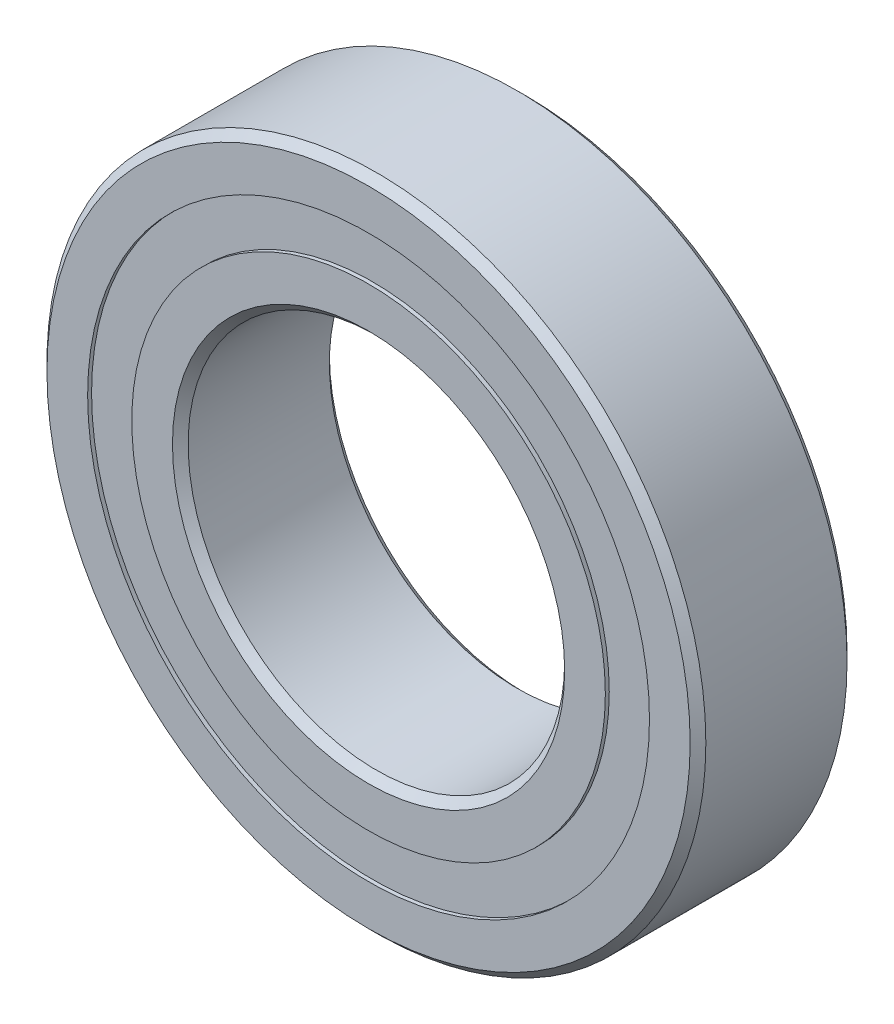
from build123d import *

# Parameters (mm, degrees)
CIRPATTERN1_COUNT = 12
SKETCH5_W         = 1.060011729
SKETCH5_H         = 1.406593406


with BuildPart() as part:
    # Sketch1 → Revolve1 (revolve)
    with BuildSketch(Plane(origin=(0, 0, 0), x_dir=(0, 0, -1), z_dir=(1, 0, 0)), mode=Mode.PRIVATE) as revolve1_sk:
        with BuildLine():
            Line((2.25, 10.5), (-2.25, 10.5))
            Line((-2.25, 10.5), (-2.5, 10.25))
            Line((-2.5, 10.25), (-2.5, 8.953296703))
            Line((-2.5, 8.953296703), (-1.111111111, 8.953296703))
            ThreePointArc((-1.111111111, 8.953296703), (0, 9.564988271), (1.111111111, 8.953296703))
            Line((1.111111111, 8.953296703), (2.5, 8.953296703))
            Line((2.5, 8.953296703), (2.5, 10.25))
            Line((2.5, 10.25), (2.25, 10.5))
        make_face()
    revolve(revolve1_sk.sketch.rotate(Axis((0, 0, 2.5), (0, 0, -1)), 90), axis=Axis((0, 0, 2.5), (0, 0, -1)))


with BuildPart() as body_2:
    # Sketch3 → Revolve3 (revolve)
    with BuildSketch(Plane(origin=(0, 0, 0), x_dir=(0, 0, -1), z_dir=(1, 0, 0)), mode=Mode.PRIVATE) as revolve3_sk:
        with BuildLine():
            Line((-2.5, 7.546703297), (-1.111111111, 7.546703297))
            ThreePointArc((-1.111111111, 7.546703297), (0, 6.935011729), (1.111111111, 7.546703297))
            Line((1.111111111, 7.546703297), (2.5, 7.546703297))
            Line((2.5, 7.546703297), (2.5, 6.25))
            Line((2.5, 6.25), (2.25, 6))
            Line((2.25, 6), (-2.25, 6))
            Line((-2.25, 6), (-2.5, 6.25))
            Line((-2.5, 6.25), (-2.5, 7.546703297))
        make_face()
    revolve(revolve3_sk.sketch.rotate(Axis((0, 0, 2.5), (0, 0, -1)), 90), axis=Axis((0, 0, 2.5), (0, 0, -1)))


with BuildPart() as body_3:
    # Sketch4 → Revolve4 (revolve)
    with BuildSketch(Plane(origin=(0, 0, 0), x_dir=(0, 0, -1), z_dir=(1, 0, 0))):
        with BuildLine():
            Line((-1.314988271, 8.25), (1.314988271, 8.25))
            ThreePointArc((1.314988271, 8.25), (0, 9.564988271), (-1.314988271, 8.25))
        make_face()
    revolve(axis=Axis((0, 8.25, 1.314988271), (0, 0, -1)))


with BuildPart() as cirpattern1_1:
    # CirPattern1: pattern copy
    add(body_3.part.rotate(Axis((0, 0, 0), (0, 0, 1)), 1 * 360 / CIRPATTERN1_COUNT))


with BuildPart() as cirpattern1_2:
    # CirPattern1: pattern copy
    add(body_3.part.rotate(Axis((0, 0, 0), (0, 0, 1)), 2 * 360 / CIRPATTERN1_COUNT))


with BuildPart() as cirpattern1_3:
    # CirPattern1: pattern copy
    add(body_3.part.rotate(Axis((0, 0, 0), (0, 0, 1)), 3 * 360 / CIRPATTERN1_COUNT))


with BuildPart() as cirpattern1_4:
    # CirPattern1: pattern copy
    add(body_3.part.rotate(Axis((0, 0, 0), (0, 0, 1)), 4 * 360 / CIRPATTERN1_COUNT))


with BuildPart() as cirpattern1_5:
    # CirPattern1: pattern copy
    add(body_3.part.rotate(Axis((0, 0, 0), (0, 0, 1)), 5 * 360 / CIRPATTERN1_COUNT))


with BuildPart() as cirpattern1_6:
    # CirPattern1: pattern copy
    add(body_3.part.rotate(Axis((0, 0, 0), (0, 0, 1)), 6 * 360 / CIRPATTERN1_COUNT))


with BuildPart() as cirpattern1_7:
    # CirPattern1: pattern copy
    add(body_3.part.rotate(Axis((0, 0, 0), (0, 0, 1)), 7 * 360 / CIRPATTERN1_COUNT))


with BuildPart() as cirpattern1_8:
    # CirPattern1: pattern copy
    add(body_3.part.rotate(Axis((0, 0, 0), (0, 0, 1)), 8 * 360 / CIRPATTERN1_COUNT))


with BuildPart() as cirpattern1_9:
    # CirPattern1: pattern copy
    add(body_3.part.rotate(Axis((0, 0, 0), (0, 0, 1)), 9 * 360 / CIRPATTERN1_COUNT))


with BuildPart() as cirpattern1_10:
    # CirPattern1: pattern copy
    add(body_3.part.rotate(Axis((0, 0, 0), (0, 0, 1)), 10 * 360 / CIRPATTERN1_COUNT))


with BuildPart() as cirpattern1_11:
    # CirPattern1: pattern copy
    add(body_3.part.rotate(Axis((0, 0, 0), (0, 0, 1)), 11 * 360 / CIRPATTERN1_COUNT))


with BuildPart() as body_15:
    # Sketch5 → Revolve5 (revolve)
    with BuildSketch(Plane(origin=(0, 0, 0), x_dir=(0, 0, -1), z_dir=(1, 0, 0)), mode=Mode.PRIVATE) as revolve5_sk:
        with Locations((-1.844994135, 8.25)):
            Rectangle(SKETCH5_W, SKETCH5_H)
        with Locations((1.844994135, 8.25)):
            Rectangle(SKETCH5_W, SKETCH5_H)
    revolve(revolve5_sk.sketch.rotate(Axis((0, 0, 2.5), (0, 0, -1)), 90), axis=Axis((0, 0, 2.5), (0, 0, -1)))


solid = Compound([part.part, body_2.part, body_3.part, cirpattern1_1.part, cirpattern1_2.part, cirpattern1_3.part, cirpattern1_4.part, cirpattern1_5.part, cirpattern1_6.part, cirpattern1_7.part, cirpattern1_8.part, cirpattern1_9.part, cirpattern1_10.part, cirpattern1_11.part, body_15.part])
